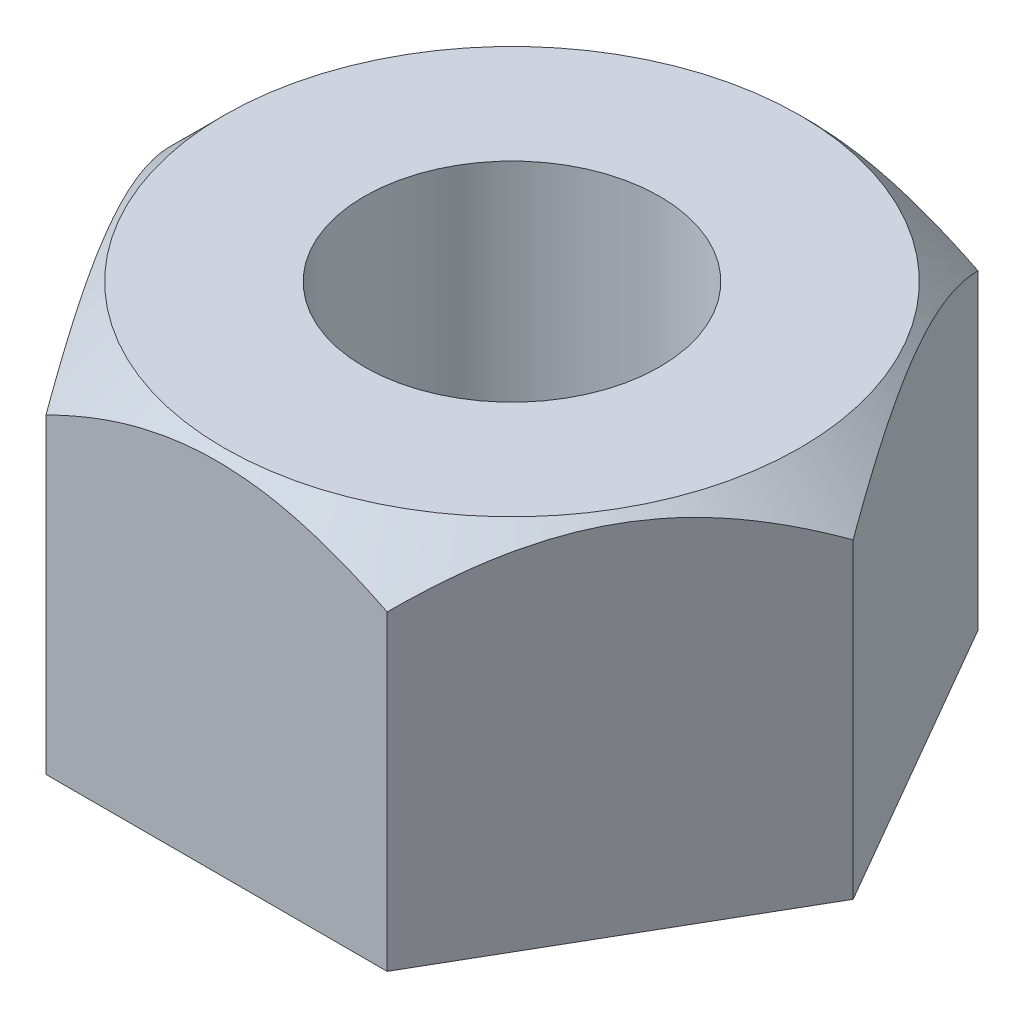
from build123d import *

# Parameters (mm, degrees)
SKETCH_1_R      = 6
EXTRUDE_1_DEPTH = 14.8


with BuildPart() as part:
    # 草图1 → 凸台-拉伸1 (new body)
    with BuildSketch(Plane(origin=(0, 0, 0), x_dir=(1, 0, 0), z_dir=(0, 1, 0))):
        Polygon((-6.92820323, 12), (-13.856406461, 0), (-6.92820323, -12), (6.92820323, -12), (13.856406461, 0), (6.92820323, 12), align=None)
        with Locations(Location((0, 0, 0), (0, 0, 270))):
            Circle(SKETCH_1_R, mode=Mode.SUBTRACT)
    extrude(amount=EXTRUDE_1_DEPTH)

    # 草图2 → 切除-旋转1 (revolve, cut)
    with BuildSketch(Plane.XY, mode=Mode.PRIVATE) as cut_revolve_1_sk:
        Polygon((9.5, 17), (15, 11.5), (15, 17), align=None)
    revolve(cut_revolve_1_sk.sketch.rotate(Axis((0, 17.647957279, 0), (0, -1, 0)), 300.00000004), axis=Axis((0, 17.647957279, 0), (0, -1, 0)), mode=Mode.SUBTRACT)


solid = part.part
